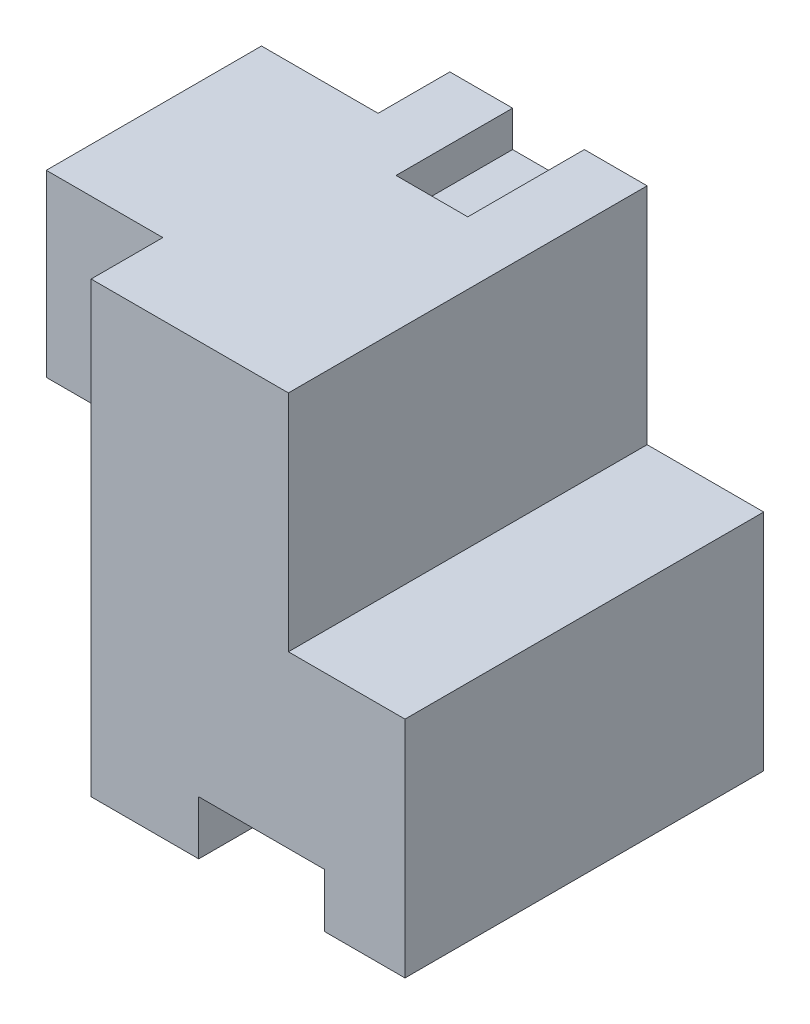
from build123d import *

# Parameters (mm, degrees)
EXTRUDE_1_DEPTH      = 20
EXTRUDE_1_DEPTH_BACK = 20
EXTRUDE_2_DEPTH      = 12
EXTRUDE_2_DEPTH_BACK = 12
SKETCH_1_3_W         = 13
SKETCH_1_3_H         = 20
SKETCH_2_W           = 14
SKETCH_2_H           = 6
CUT_EXTRUDE_1_DEPTH  = 8
SKETCH_3_W           = 8
SKETCH_3_H           = 13
CUT_EXTRUDE_2_DEPTH  = 4


with BuildPart() as part:
    # Эскиз1 → Бобышка-Вытянуть1 (new, two sides: drawn at the far end of the back side and taken through both)
    with BuildSketch(Plane.XY.offset(-EXTRUDE_1_DEPTH_BACK)):
        Polygon((-17.5, 5), (-17.5, -25), (17.5, -25), (17.5, 0), (4.5, 0), (4.5, 25), (-17.5, 25), align=None)
    extrude(amount=EXTRUDE_1_DEPTH + EXTRUDE_1_DEPTH_BACK)

    # Эскиз1<3> → Бобышка-Вытянуть2 (add, two sides: drawn at the far end of the back side and taken through both)
    with BuildSketch(Plane.XY.offset(-EXTRUDE_2_DEPTH_BACK)):
        with Locations((-24, 15)):
            Rectangle(SKETCH_1_3_W, SKETCH_1_3_H)
    extrude(amount=EXTRUDE_2_DEPTH + EXTRUDE_2_DEPTH_BACK)

    # Эскиз2 → Вырез-Вытянуть1 (cut)
    with BuildSketch(Plane.XY.offset(20)):
        with Locations((1.5, -22)):
            Rectangle(SKETCH_2_W, SKETCH_2_H)
    extrude(amount=-CUT_EXTRUDE_1_DEPTH, mode=Mode.SUBTRACT)

    # Эскиз3 → Вырез-Вытянуть2 (cut)
    with BuildSketch(Plane(origin=(0, 25, 0), x_dir=(1, 0, 0), z_dir=(0, 1, 0))):
        with Locations((-6.5, 13.5)):
            Rectangle(SKETCH_3_W, SKETCH_3_H)
    extrude(amount=-CUT_EXTRUDE_2_DEPTH, mode=Mode.SUBTRACT)


solid = part.part
